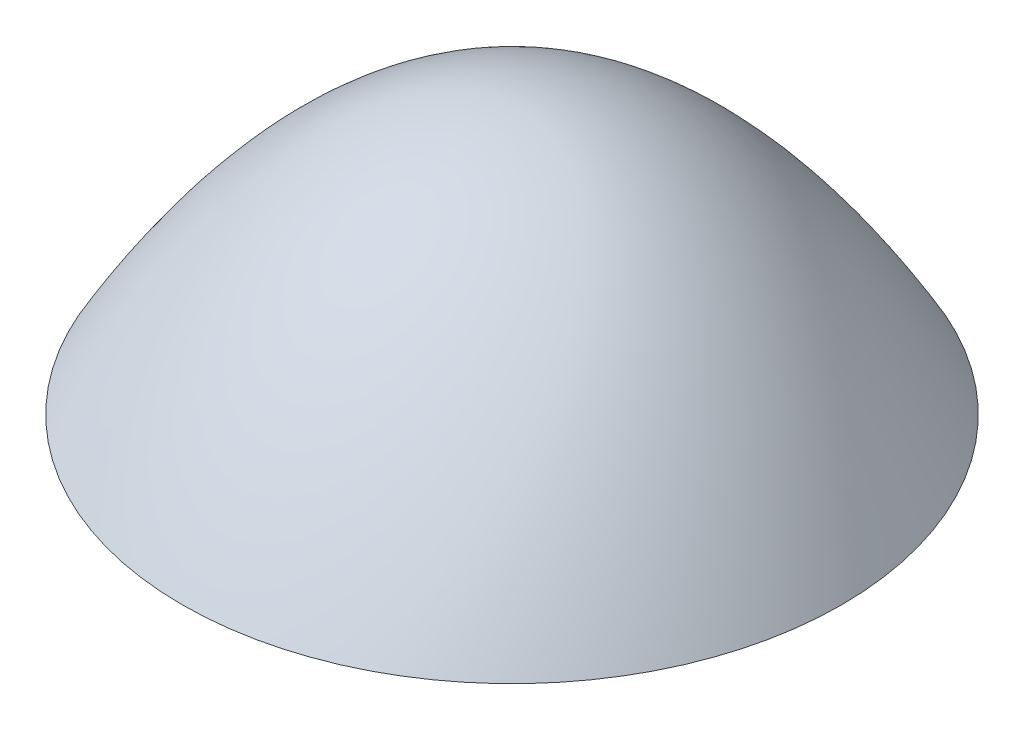
from build123d import *

# Parameters (mm, degrees)
BOSS_EXTRUDE1_START = -304.8
SKETCH2_R           = 76.2
SKETCH2_R_2         = 74.2
BOSS_EXTRUDE1_DEPTH = 304.8
SKETCH3_R           = 134.747251172
CUT_EXTRUDE1_DEPTH  = 537.314284008


with BuildPart() as part:
    # Sketch1 → Revolve1 (revolve)
    with BuildSketch(Plane.XY, mode=Mode.PRIVATE) as revolve1_sk:
        with BuildLine():
            Line((76.2, 150), (76.2, 0))
            Line((76.2, 0), (78.16, 0))
            Line((78.16, 0), (78.16, 150))
            add(Edge.make_bspline(
                [(0, 400), (2.723149784, 400), (8.095363208, 399.131102803), (15.985209364, 395.313409978), (23.550682528, 389.130576689), (33.207143777, 377.875372886), (44.403572502, 358.368758892), (56.109342912, 327.087146412), (65.689764926, 289.080732548), (71.61438571, 252.993821619), (74.98797824, 222.299614595), (76.812690029, 198.58573428), (77.914396428, 174.415956203), (78.16, 158.124741441), (78.16, 150)],
                knots=[-1.570796327, -1.570796327, -1.570796327, -1.570796327, -1.472621556, -1.374446786, -1.276272016, -1.178097245, -0.981747704, -0.785398163, -0.589048623, -0.392699082, -0.294524311, -0.196349541, -0.09817477, 0, 0, 0, 0], degree=3))
            Line((0, 400), (0, 398.04))
            add(Edge.make_bspline(
                [(76.2, 150), (76.2, 398.04), (0, 398.04)],
                knots=[4.71238898, 4.71238898, 4.71238898, 6.283185307, 6.283185307, 6.283185307], degree=2, weights=[1, 0.707106781, 1]))
        make_face()
    revolve(revolve1_sk.sketch.rotate(Axis((0, 0, 0), (0, 1, 0)), 90), axis=Axis((0, 0, 0), (0, 1, 0)))

    # Sketch2 → Boss-Extrude1 (add)
    with BuildSketch(Plane(origin=(0, 150, 0), x_dir=(1, 0, 0), z_dir=(0, 1, 0)).offset(BOSS_EXTRUDE1_START)):
        with Locations(Location((0, 0, 0), (0, 0, 270))):
            Circle(SKETCH2_R)
        with Locations(Location((0, 0, 0), (0, 0, 270))):
            Circle(SKETCH2_R_2, mode=Mode.SUBTRACT)
    extrude(amount=BOSS_EXTRUDE1_DEPTH)

    # Sketch3 → Cut-Extrude1 (cut, through all)
    with BuildSketch(Plane(origin=(0, 370, 0), x_dir=(-1, 0, 0), z_dir=(0, -1, 0))):
        Circle(SKETCH3_R)
    extrude(amount=CUT_EXTRUDE1_DEPTH, mode=Mode.SUBTRACT)


solid = part.part
